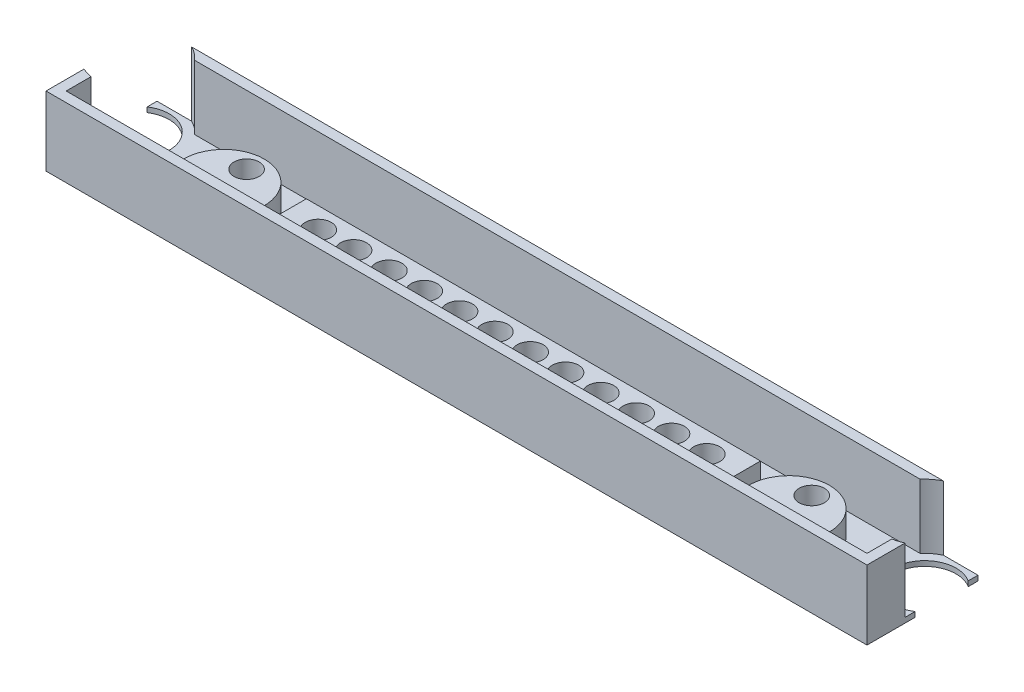
from build123d import *

# Parameters (mm, degrees)
SKETCH1_W           = 162.7
SKETCH1_H           = 22
BOSS_EXTRUDE1_DEPTH = 13.75
SKETCH2_W           = 158.7
SKETCH2_H           = 18
CUT_EXTRUDE1_DEPTH  = 12.75
SKETCH4_W           = 90
SKETCH4_H           = 8.5
BOSS_EXTRUDE2_DEPTH = 5.8
SKETCH3_R           = 2.575
CUT_EXTRUDE2_DEPTH  = 84.233917365
SKETCH7_R           = 8
CUT_EXTRUDE4_DEPTH  = 12.75
SKETCH5_R           = 6.25
CUT_EXTRUDE5_DEPTH  = 84.233917365
SKETCH8_R           = 8
BOSS_EXTRUDE4_DEPTH = 4.8
SKETCH10_W          = 90
SKETCH10_H          = 8.5
CUT_EXTRUDE6_DEPTH  = 1
SKETCH11_R          = 2.5
CUT_EXTRUDE7_DEPTH  = 83.474389964


with BuildPart() as part:
    # Sketch1 → Boss-Extrude1 (new body)
    with BuildSketch(Plane(origin=(0, 0, 0), x_dir=(1, 0, 0), z_dir=(0, 1, 0))):
        Rectangle(SKETCH1_W, SKETCH1_H)
    extrude(amount=BOSS_EXTRUDE1_DEPTH)

    # Sketch2 → Cut-Extrude1 (cut)
    with BuildSketch(Plane(origin=(0, 13.75, 0), x_dir=(1, 0, 0), z_dir=(0, 1, 0))):
        Rectangle(SKETCH2_W, SKETCH2_H)
    extrude(amount=-CUT_EXTRUDE1_DEPTH, mode=Mode.SUBTRACT)

    # Sketch4 → Boss-Extrude2 (add)
    with BuildSketch(Plane(origin=(0, 1, 0), x_dir=(1, 0, 0), z_dir=(0, 1, 0))):
        Rectangle(SKETCH4_W, SKETCH4_H)
    extrude(amount=BOSS_EXTRUDE2_DEPTH)

    # Sketch3 → Cut-Extrude2 (cut, through all)
    with BuildSketch(Plane.XZ):
        with Locations(Location((-3.5, -0.1, 0), (0, 0, 270))):
            Circle(SKETCH3_R)
        with Locations(Location((-10.5, -0.1, 0), (0, 0, 270))):
            Circle(SKETCH3_R)
        with Locations(Location((-17.5, -0.1, 0), (0, 0, 270))):
            Circle(SKETCH3_R)
        with Locations(Location((-24.5, -0.1, 0), (0, 0, 270))):
            Circle(SKETCH3_R)
        with Locations(Location((-31.5, -0.1, 0), (0, 0, 270))):
            Circle(SKETCH3_R)
        with Locations(Location((-38.5, -0.1, 0), (0, 0, 270))):
            Circle(SKETCH3_R)
        with Locations(Location((38.5, -0.1, 0), (0, 0, 270))):
            Circle(SKETCH3_R)
        with Locations(Location((31.5, -0.1, 0), (0, 0, 270))):
            Circle(SKETCH3_R)
        with Locations(Location((24.5, -0.1, 0), (0, 0, 270))):
            Circle(SKETCH3_R)
        with Locations(Location((17.5, -0.1, 0), (0, 0, 270))):
            Circle(SKETCH3_R)
        with Locations(Location((10.5, -0.1, 0), (0, 0, 270))):
            Circle(SKETCH3_R)
        with Locations(Location((3.5, -0.1, 0), (0, 0, 270))):
            Circle(SKETCH3_R)
    extrude(amount=-CUT_EXTRUDE2_DEPTH, mode=Mode.SUBTRACT)

    # Sketch7 → Cut-Extrude4 (cut)
    with BuildSketch(Plane(origin=(0, 13.75, 0), x_dir=(1, 0, 0), z_dir=(0, 1, 0))):
        with Locations((-77.98, 3.8)):
            Circle(SKETCH7_R)
        with Locations((77.98, 3.8)):
            Circle(SKETCH7_R)
    extrude(amount=-CUT_EXTRUDE4_DEPTH, mode=Mode.SUBTRACT)

    # Sketch5 → Cut-Extrude5 (cut, through all)
    with BuildSketch(Plane.XZ):
        with Locations((-77.98, -3.8)):
            Circle(SKETCH5_R)
        with Locations((77.98, -3.8)):
            Circle(SKETCH5_R)
    extrude(amount=-CUT_EXTRUDE5_DEPTH, mode=Mode.SUBTRACT)

    # Sketch8 → Boss-Extrude4 (add)
    with BuildSketch(Plane(origin=(0, 1, 0), x_dir=(1, 0, 0), z_dir=(0, 1, 0))):
        with Locations((-56, -1.1)):
            Circle(SKETCH8_R)
        with Locations((56, -1.1)):
            Circle(SKETCH8_R)
    extrude(amount=BOSS_EXTRUDE4_DEPTH)

    # Sketch10 → Cut-Extrude6 (cut)
    with BuildSketch(Plane(origin=(0, 6.8, 0), x_dir=(1, 0, 0), z_dir=(0, 1, 0))):
        Rectangle(SKETCH10_W, SKETCH10_H)
    extrude(amount=-CUT_EXTRUDE6_DEPTH, mode=Mode.SUBTRACT)

    # Sketch11 → Cut-Extrude7 (cut, through all)
    with BuildSketch(Plane(origin=(0, 5.8, 0), x_dir=(1, 0, 0), z_dir=(0, 1, 0))):
        with Locations(Location((-56, 3.4, 0), (0, 0, 270))):
            Circle(SKETCH11_R)
        with Locations(Location((-59.181980515, -4.281980515, 0), (0, 0, 270))):
            Circle(SKETCH11_R)
        with Locations(Location((-52.818019485, -4.281980515, 0), (0, 0, 270))):
            Circle(SKETCH11_R)
        with Locations(Location((52.818019485, -4.281980515, 0), (0, 0, 90))):
            Circle(SKETCH11_R)
        with Locations(Location((59.181980515, -4.281980515, 0), (0, 0, 90))):
            Circle(SKETCH11_R)
        with Locations(Location((56, 3.4, 0), (0, 0, 90))):
            Circle(SKETCH11_R)
    extrude(amount=-CUT_EXTRUDE7_DEPTH, mode=Mode.SUBTRACT)


solid = part.part
